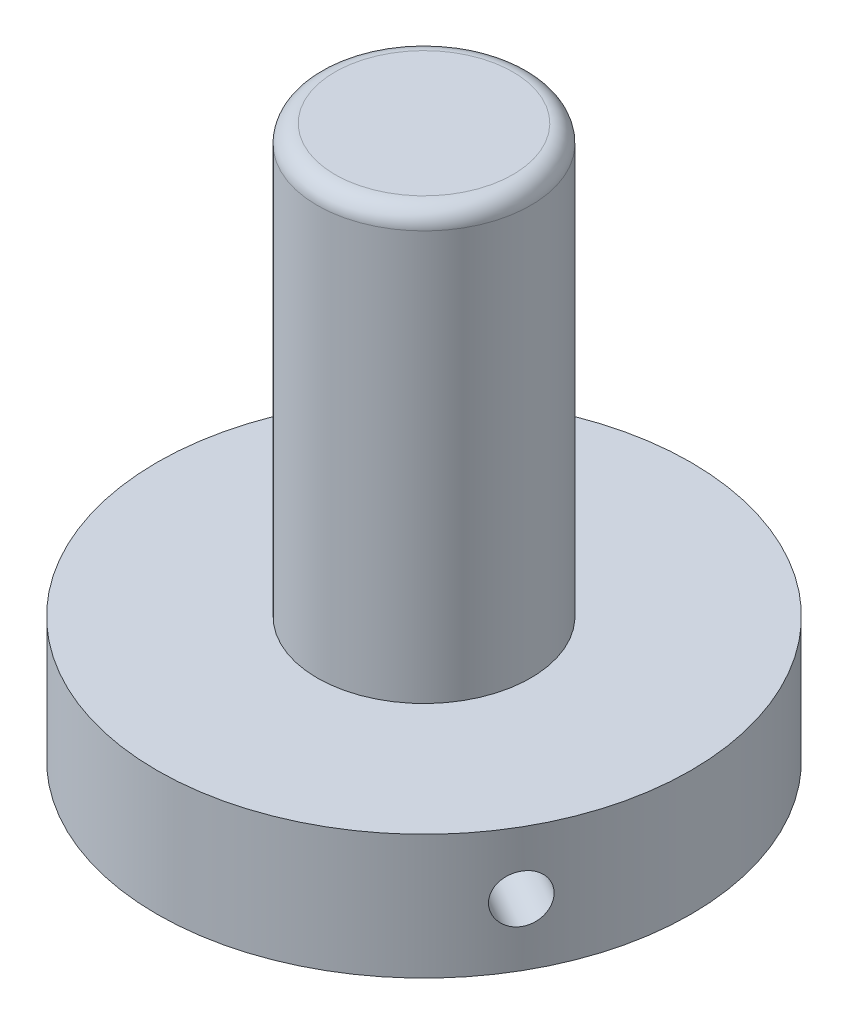
from build123d import *

# Parameters (mm, degrees)
SKICA1_R                 = 15
P_IDAT_VYSUNUT_M1_DEPTH  = 7
SKICA3_R                 = 6
P_IDAT_VYSUNUT_M2_DEPTH  = 24
ZAOBLIT1_R               = 1
SKICA5_R                 = 2.5
ODEBRAT_VYSUNUT_M1_DEPTH = 22
ZAOBLIT3_R               = 0.5
SKICA6_R                 = 1.35
ODEBRAT_VYSUNUT_M3_DEPTH = 38.563280025
KRUHOV_POLE1_COUNT       = 3


with BuildPart() as part:
    # Skica1 → Přidat vysunutím1 (new body)
    with BuildSketch(Plane(origin=(0, 0, 0), x_dir=(1, 0, 0), z_dir=(0, 1, 0))):
        with Locations(Location((0, 0, 0), (0, 0, 270))):
            Circle(SKICA1_R)
    extrude(amount=P_IDAT_VYSUNUT_M1_DEPTH)

    # Skica3 → Přidat vysunutím2 (add)
    with BuildSketch(Plane(origin=(0, 7, 0), x_dir=(1, 0, 0), z_dir=(0, 1, 0))):
        with Locations(Location((0, 0, 0), (0, 0, 270))):
            Circle(SKICA3_R)
    extrude(amount=P_IDAT_VYSUNUT_M2_DEPTH)

    # Zaoblit1
    zaoblit1_edges = [part.edges().sort_by_distance(p)[0] for p in [
        (0, 31, -6),
    ]]
    fillet(zaoblit1_edges, radius=ZAOBLIT1_R)

    # Skica5 → Odebrat vysunutím1 (cut)
    with BuildSketch(Plane.XZ):
        with Locations(Location((0, 0, 0), (0, 0, 270))):
            Circle(SKICA5_R)
    extrude(amount=-ODEBRAT_VYSUNUT_M1_DEPTH, mode=Mode.SUBTRACT)

    # Zaoblit3
    zaoblit3_edges = [part.edges().sort_by_distance(p)[0] for p in [
        (0, 0, 2.5),
    ]]
    fillet(zaoblit3_edges, radius=ZAOBLIT3_R)

    # Skica6 → Odebrat vysunutím3 (cut, through all)
    with BuildSketch(Plane.XY):
        with Locations(Location((0, 3.5, 0), (0, 0, 90))):
            Circle(SKICA6_R)
    odebrat_vysunut_m3 = extrude(amount=-ODEBRAT_VYSUNUT_M3_DEPTH, mode=Mode.SUBTRACT)

    # Kruhové pole1: Odebrat vysunutím3 ×3 about axis
    kruhov_pole1_axis = Axis((0, 0, 0), (0, -1, 0))
    for i in range(1, KRUHOV_POLE1_COUNT):
        add(odebrat_vysunut_m3.rotate(kruhov_pole1_axis, i * 360 / KRUHOV_POLE1_COUNT), mode=Mode.SUBTRACT)


solid = part.part
